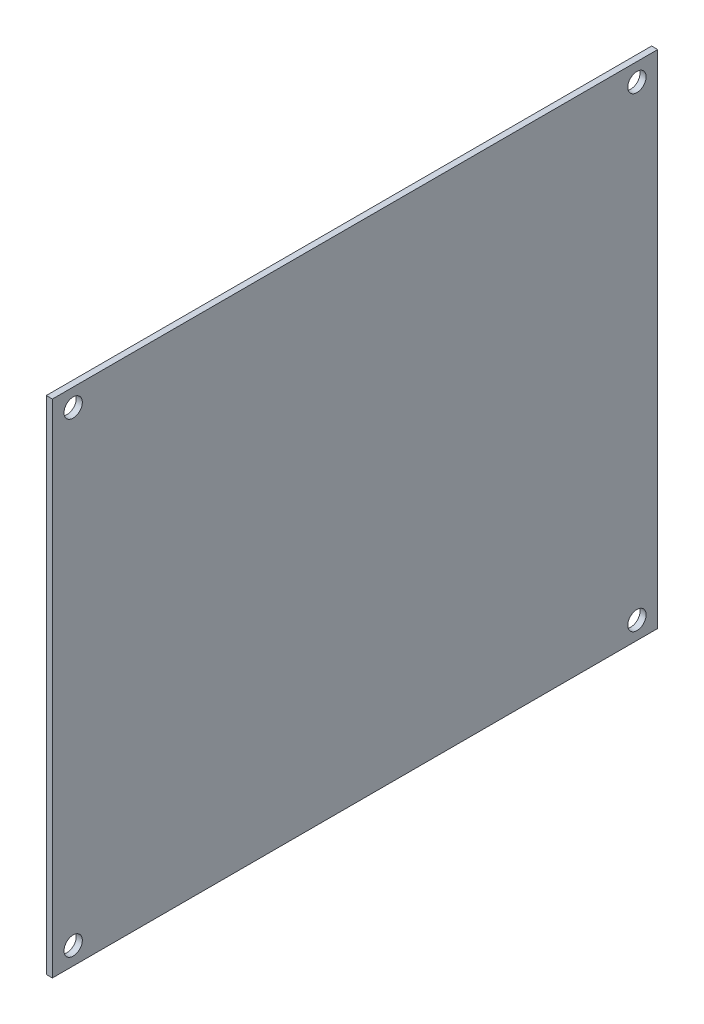
from build123d import *

# Parameters (mm, degrees)
SKETCH1_W           = 82
SKETCH1_H           = 99
SKETCH1_R           = 1.5
BOSS_EXTRUDE1_DEPTH = 1


with BuildPart() as part:
    # Sketch1 → Boss-Extrude1 (new body)
    with BuildSketch(Plane.YZ):
        with Locations((41, 49.5)):
            Rectangle(SKETCH1_W, SKETCH1_H)
        with Locations(Location((2.9, 3.4, 0), (0, 0, 270))):
            Circle(SKETCH1_R, mode=Mode.SUBTRACT)
        with Locations(Location((2.9, 95.6, 0), (0, 0, 270))):
            Circle(SKETCH1_R, mode=Mode.SUBTRACT)
        with Locations(Location((79.1, 95.6, 0), (0, 0, 270))):
            Circle(SKETCH1_R, mode=Mode.SUBTRACT)
        with Locations(Location((79.1, 3.4, 0), (0, 0, 270))):
            Circle(SKETCH1_R, mode=Mode.SUBTRACT)
    extrude(amount=BOSS_EXTRUDE1_DEPTH)


solid = part.part
